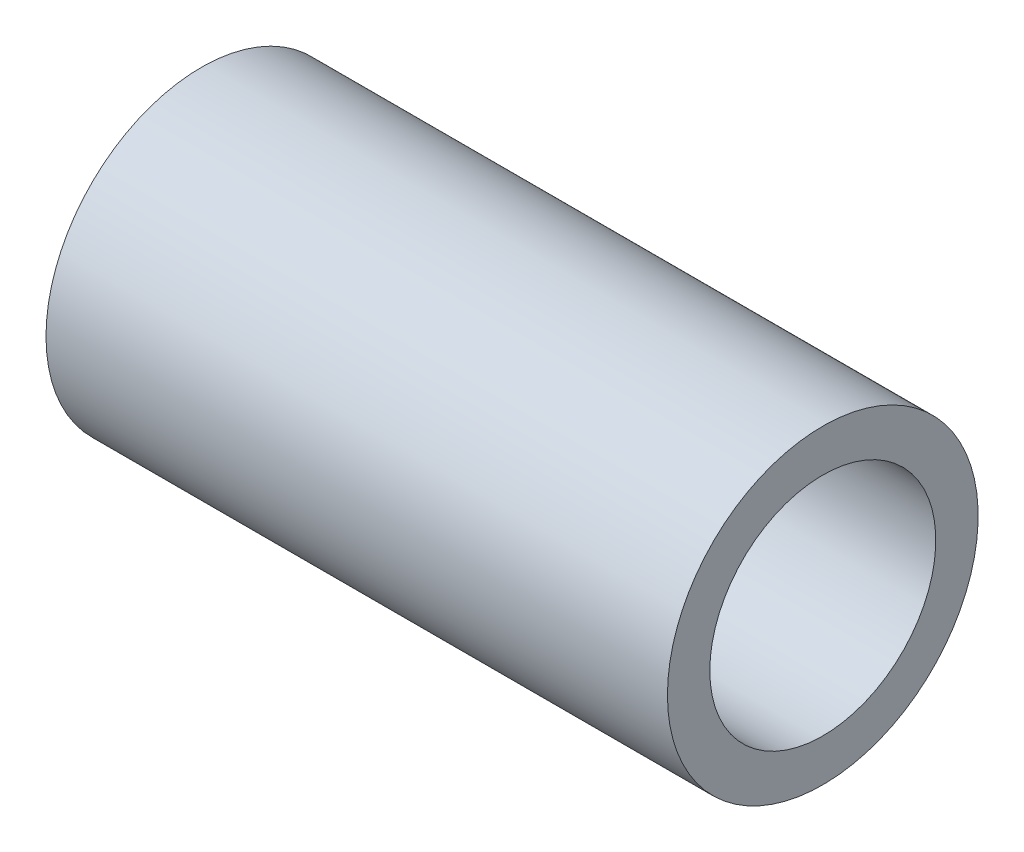
from build123d import *

# Parameters (mm, degrees)
ESBO_O1_W = 22
ESBO_O1_H = 1.5


with BuildPart() as part:
    # Esboço1 → Corpo - Furo Ø8x22 (revolve)
    with BuildSketch(Plane.XY, mode=Mode.PRIVATE) as corpo_furo_8x22_sk:
        with Locations((11, 4.75)):
            Rectangle(ESBO_O1_W, ESBO_O1_H)
    revolve(corpo_furo_8x22_sk.sketch.rotate(Axis((0, 0, 0), (1, 0, 0)), 90), axis=Axis((0, 0, 0), (1, 0, 0)))


solid = part.part
